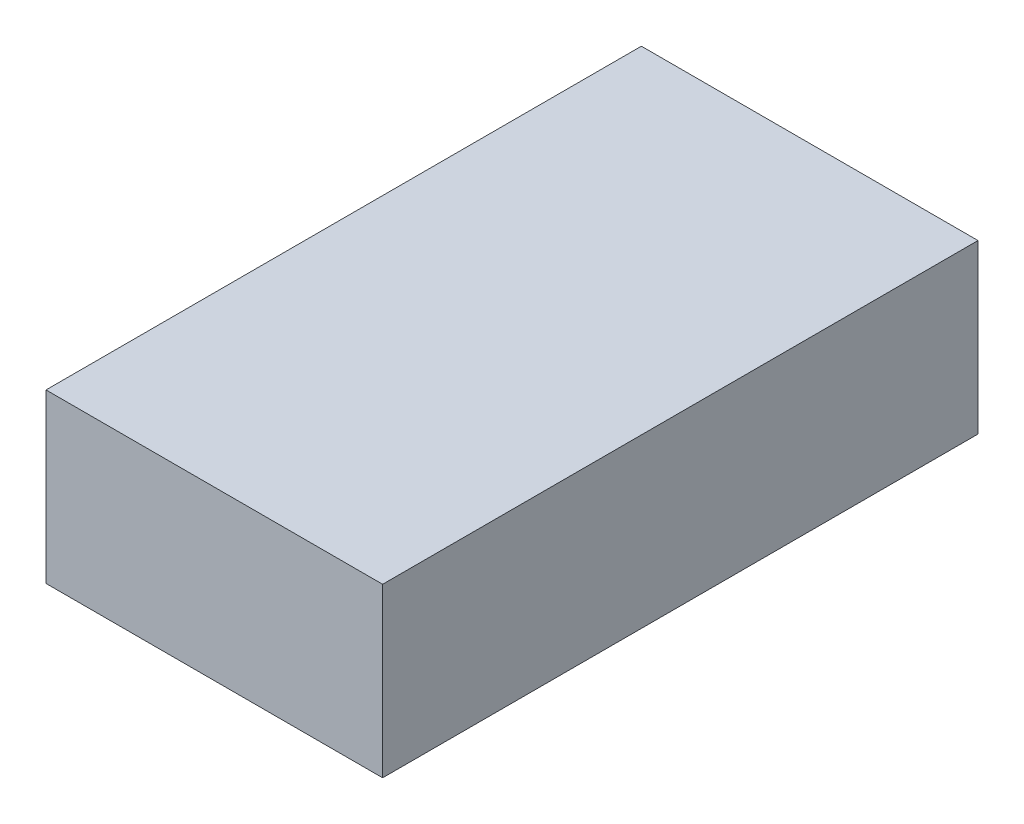
from build123d import *

# Parameters (mm, degrees)
SKETCH2_W           = 303.055537772
SKETCH2_H           = 150.904236078
BOSS_EXTRUDE1_DEPTH = 536


with BuildPart() as part:
    # Sketch2 → Boss-Extrude1 (new body)
    with BuildSketch(Plane.XY):
        with Locations((151.527768886, 16.476815692)):
            Rectangle(SKETCH2_W, SKETCH2_H)
    extrude(amount=-BOSS_EXTRUDE1_DEPTH)


solid = part.part
